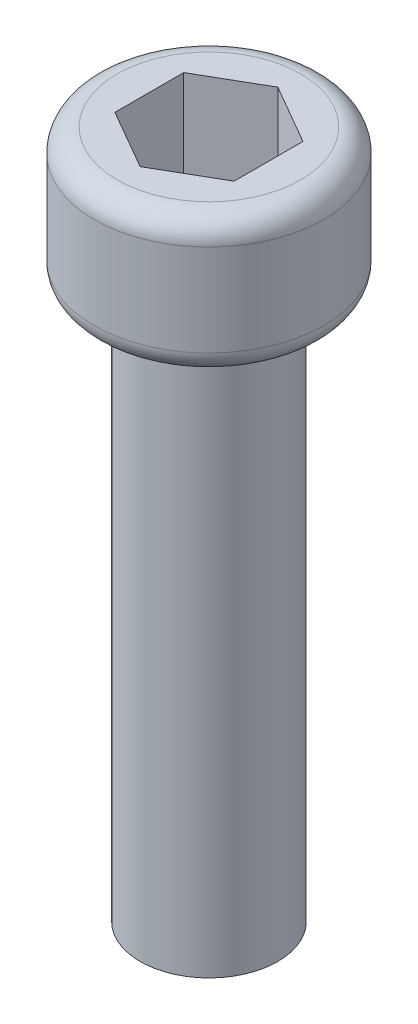
from build123d import *

# Parameters (mm, degrees)
SKETCH_1_R          = 2.5
EXTRUDE_1_DEPTH     = 3
CUT_EXTRUDE_1_DEPTH = 2
SKETCH_3_R          = 1.5
EXTRUDE_2_DEPTH     = 10
FILLET_1_R          = 0.5
SKETCH_4_R          = 1.5
EXTRUDE_3_DEPTH     = 2


with BuildPart() as part:
    # 草图1 → 凸台-拉伸1 (new body)
    with BuildSketch(Plane(origin=(0, 0, 0), x_dir=(1, 0, 0), z_dir=(0, 1, 0))):
        with Locations(Location((0, 0, 0), (0, 0, 270))):
            Circle(SKETCH_1_R)
    extrude(amount=EXTRUDE_1_DEPTH)

    # 草图2 → 切除-拉伸1 (cut)
    with BuildSketch(Plane(origin=(0, 3, 0), x_dir=(1, 0, 0), z_dir=(0, 1, 0))):
        Polygon((0, 1.5), (-1.299038106, 0.75), (-1.299038106, -0.75), (0, -1.5), (1.299038106, -0.75), (1.299038106, 0.75), align=None)
    extrude(amount=-CUT_EXTRUDE_1_DEPTH, mode=Mode.SUBTRACT)

    # 草图3 → 凸台-拉伸2 (add)
    with BuildSketch(Plane.XZ):
        with Locations(Location((0, 0, 0), (0, 0, 270))):
            Circle(SKETCH_3_R)
    extrude(amount=EXTRUDE_2_DEPTH)

    # 圆角1
    fillet_1_edges = [part.edges().sort_by_distance(p)[0] for p in [
        (0, 0, -2.5),
        (0, 3, -2.5),
    ]]
    fillet(fillet_1_edges, radius=FILLET_1_R)

    # 草图4 → 凸台-拉伸3 (add)
    with BuildSketch(Plane.XZ.offset(10)):
        with Locations(Location((0, 0, 0), (0, 0, 270))):
            Circle(SKETCH_4_R)
    extrude(amount=EXTRUDE_3_DEPTH)


solid = part.part
